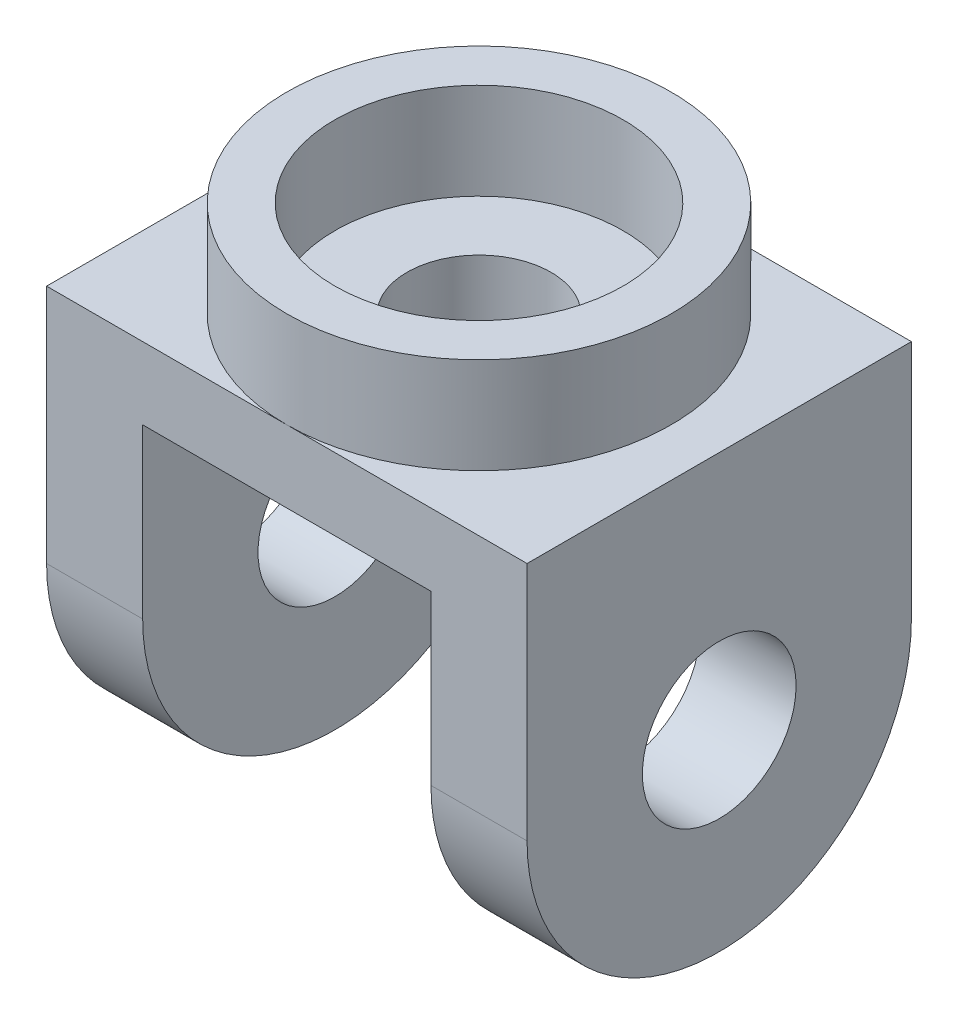
from build123d import *

# Parameters (mm, degrees)
BOSS_EXTRUDE1_DEPTH = 80
BOSS_EXTRUDE2_DEPTH = 20
SKETCH3_R           = 16
CUT_EXTRUDE1_DEPTH  = 20
SKETCH4_R           = 40
SKETCH4_R_2         = 30
BOSS_EXTRUDE3_DEPTH = 20
SKETCH5_R           = 15
CUT_EXTRUDE2_DEPTH  = 131.384048104


with BuildPart() as part:
    # Sketch1 → Boss-Extrude1 (new body)
    with BuildSketch(Plane.XY):
        Polygon((30, -25), (50, -25), (50, 25), (-50, 25), (-50, -25), (-30, -25), (-30, 10), (30, 10), align=None)
    extrude(amount=-BOSS_EXTRUDE1_DEPTH)

    # Sketch2 → Boss-Extrude2 (add)
    with BuildSketch(Plane(origin=(50, 0, 0), x_dir=(0, 0, -1), z_dir=(1, 0, 0))):
        with BuildLine():
            Line((0, -25), (80, -25))
            ThreePointArc((80, -25), (40, -65), (0, -25))
        make_face()
    boss_extrude2 = extrude(amount=-BOSS_EXTRUDE2_DEPTH)

    # Sketch3 → Cut-Extrude1 (cut)
    with BuildSketch(Plane(origin=(50, 0, 0), x_dir=(0, 0, -1), z_dir=(1, 0, 0))):
        with Locations((40, -25)):
            Circle(SKETCH3_R)
    cut_extrude1 = extrude(amount=-CUT_EXTRUDE1_DEPTH, mode=Mode.SUBTRACT)

    # Mirror1: Boss-Extrude2, Cut-Extrude1 across plane
    add(boss_extrude2.mirror(Plane(origin=(0, 0, 0), x_dir=(0, 0, 1), z_dir=(1, 0, 0))))
    add(cut_extrude1.mirror(Plane(origin=(0, 0, 0), x_dir=(0, 0, 1), z_dir=(1, 0, 0))), mode=Mode.SUBTRACT)

    # Sketch4 → Boss-Extrude3 (add)
    with BuildSketch(Plane(origin=(0, 25, 0), x_dir=(1, 0, 0), z_dir=(0, 1, 0))):
        with Locations(Location((0, 40, 0), (0, 0, 270))):
            Circle(SKETCH4_R)
        with Locations(Location((0, 40, 0), (0, 0, 270))):
            Circle(SKETCH4_R_2, mode=Mode.SUBTRACT)
    extrude(amount=BOSS_EXTRUDE3_DEPTH)

    # Sketch5 → Cut-Extrude2 (cut, through all)
    with BuildSketch(Plane(origin=(0, 25, 0), x_dir=(1, 0, 0), z_dir=(0, 1, 0))):
        with Locations(Location((0, 40, 0), (0, 0, 270))):
            Circle(SKETCH5_R)
    extrude(amount=-CUT_EXTRUDE2_DEPTH, mode=Mode.SUBTRACT)


solid = part.part
